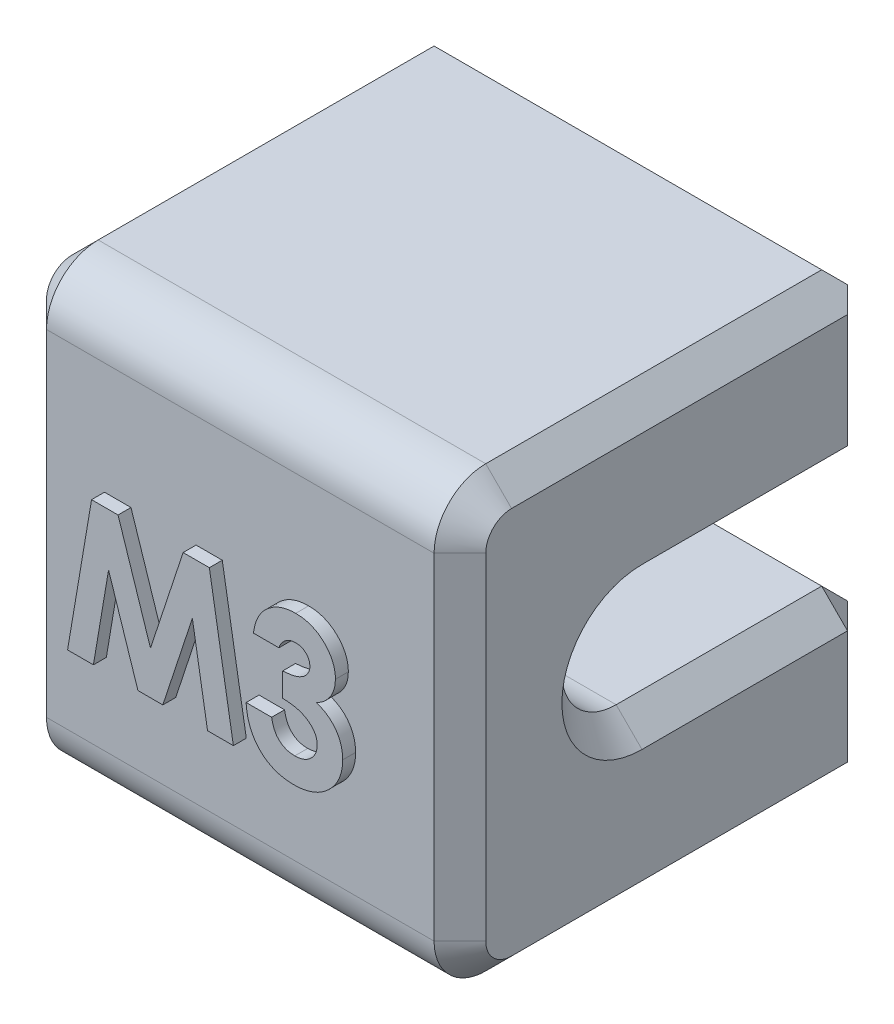
from build123d import *

# Parameters (mm, degrees)
SKETCH1_W           = 17
SKETCH1_H           = 17
BOSS_EXTRUDE1_DEPTH = 16
CUT_EXTRUDE1_DEPTH  = 29.879058156
CHAMFER1_SIZE       = 1
FILLET1_R           = 2
BOSS_EXTRUDE2_DEPTH = 0.5
CHAMFER3_SIZE       = 1


with BuildPart() as part:
    # Sketch1 → Boss-Extrude1 (new body)
    with BuildSketch(Plane.XY):
        with Locations((8.5, 8.5)):
            Rectangle(SKETCH1_W, SKETCH1_H)
    extrude(amount=BOSS_EXTRUDE1_DEPTH)

    # Sketch2 → Cut-Extrude1 (cut, through all)
    with BuildSketch(Plane.ZY):
        with BuildLine():
            Line((8.953848021, 10.6), (0, 10.6))
            Line((0, 10.6), (0, 6.4))
            Line((0, 6.4), (8.953848021, 6.4))
            ThreePointArc((8.953848021, 6.4), (11.053848021, 8.5), (8.953848021, 10.6))
        make_face()
    extrude(amount=-CUT_EXTRUDE1_DEPTH, mode=Mode.SUBTRACT)

    # Chamfer1
    chamfer1_edges = [part.edges().sort_by_distance(p)[0] for p in [
        (0, 3.2, 0),
        (17, 13.8, 0),
        (17, 8.5, 11.053848021),
        (17, 6.4, 4.47692401),
        (8.5, 6.4, 0),
        (17, 10.6, 4.47692401),
        (8.5, 10.6, 0),
        (0, 8.5, 11.053848021),
        (0, 10.6, 4.47692401),
        (0, 6.4, 4.47692401),
        (8.5, 17, 0),
        (17, 3.2, 0),
        (8.5, 0, 0),
        (0, 13.8, 0),
    ]]
    chamfer(chamfer1_edges, length=CHAMFER1_SIZE)

    # Fillet1
    fillet1_edges = [part.edges().sort_by_distance(p)[0] for p in [
        (8.5, 17, 16),
        (8.5, 0, 16),
    ]]
    fillet(fillet1_edges, radius=FILLET1_R)

    # Sketch3 → Boss-Extrude2 (add)
    with BuildSketch(Plane.XY.offset(16)):
        Polygon((3.244919175, 10.668082206), (4.269558598, 10.668082206), (5.524466451, 6.831744065), (6.788188406, 10.668082206), (7.802911963, 10.668082206), (8.732799784, 5.168082206), (7.733500906, 5.168082206), (7.146261322, 8.641940379), (6.002631515, 5.168082206), (5.039690809, 5.168082206), (3.902671579, 8.641940379), (3.316533758, 5.168082206), (2.316133117, 5.168082206), align=None)
        with BuildLine():
            Line((10.495620297, 9.328338616), (9.508440809, 9.328338616))
            add(Edge.make_bspline(
                [(9.508440809, 9.328338616), (9.515410672, 9.377684197), (9.529074626, 9.47442294), (9.56177064, 9.61447654), (9.600878602, 9.747326965), (9.649702894, 9.872553504), (9.706965845, 9.990379227), (9.772085156, 10.101208455), (9.84576479, 10.204565488), (9.90224101, 10.266828175), (9.93041597, 10.297889898)],
                knots=[0, 0, 0, 0, 1.111473889, 2.178970933, 3.205615836, 4.199322666, 5.174200091, 6.12565194, 7.064921805, 8, 8, 8, 8], degree=3))
            add(Edge.make_bspline(
                [(9.93041597, 10.297889898), (9.971054616, 10.338873592), (10.051149118, 10.419648144), (10.184996423, 10.523111423), (10.325293118, 10.612651854), (10.474852914, 10.683640156), (10.631348547, 10.741096963), (10.796024526, 10.779690829), (10.968207924, 10.805298201), (11.085701432, 10.807820616), (11.145660361, 10.809107847)],
                knots=[0, 0, 0, 0, 1.01925491, 2.00884431, 2.983262333, 3.955970413, 4.92937149, 5.924503185, 6.940838805, 8, 8, 8, 8], degree=3))
            add(Edge.make_bspline(
                [(11.145660361, 10.809107847), (11.198966933, 10.807849383), (11.303756913, 10.805375497), (11.457771816, 10.785516482), (11.604612137, 10.750685982), (11.745830021, 10.705145883), (11.879348613, 10.643180969), (12.008114798, 10.571252892), (12.128530844, 10.483030116), (12.240878502, 10.383347258), (12.344091254, 10.275530489), (12.433473949, 10.160283229), (12.510317856, 10.040683999), (12.573627071, 9.915739156), (12.622303254, 9.785237276), (12.656085968, 9.649932253), (12.678197575, 9.510122647), (12.680400469, 9.415095941), (12.681517733, 9.366900315)],
                knots=[0, 0, 0, 0, 1.091422571, 2.145516843, 3.172569842, 4.178562979, 5.178154469, 6.181868002, 7.194278174, 8.227918432, 9.254613415, 10.245994977, 11.209837596, 12.161663635, 13.10878368, 14.055455738, 15.013766427, 16, 16, 16, 16], degree=3))
            add(Edge.make_bspline(
                [(12.681517733, 9.366900315), (12.679225042, 9.307214046), (12.674711438, 9.189710131), (12.637674052, 9.017734423), (12.579700472, 8.853294955), (12.495951997, 8.698692484), (12.391245073, 8.55434775), (12.262773184, 8.425086631), (12.114195543, 8.308882488), (12.002656329, 8.246434368), (11.945540168, 8.214456405)],
                knots=[0, 0, 0, 0, 0.992805628, 1.954529043, 2.915727527, 3.886831945, 4.871318353, 5.87440735, 6.911542536, 8, 8, 8, 8], degree=3))
            add(Edge.make_bspline(
                [(11.945540168, 8.214456405), (11.984743825, 8.201585019), (12.061777251, 8.176293323), (12.171271003, 8.126481615), (12.275387051, 8.072045674), (12.372332552, 8.00880546), (12.463071747, 7.939318128), (12.547051478, 7.862989674), (12.624773506, 7.77998653), (12.69496905, 7.689852211), (12.757270338, 7.594028239), (12.813169966, 7.494728091), (12.859178476, 7.390445863), (12.898153411, 7.282372527), (12.927826708, 7.169536779), (12.948719361, 7.052375846), (12.960795827, 6.931156981), (12.962637694, 6.849031274), (12.963569015, 6.807505283)],
                knots=[0, 0, 0, 0, 1.059543567, 2.081955587, 3.086750234, 4.076226789, 5.052108497, 6.020845489, 6.989030705, 7.970690546, 8.952259656, 9.923888338, 10.895517021, 11.877585046, 12.873342345, 13.889638361, 14.932918083, 16, 16, 16, 16], degree=3))
            add(Edge.make_bspline(
                [(12.963569015, 6.807505283), (12.961681103, 6.746478937), (12.957958525, 6.626147412), (12.93429212, 6.448911389), (12.890229538, 6.279932588), (12.83226277, 6.117266652), (12.754941393, 5.96301354), (12.663947131, 5.813633354), (12.5520969, 5.674306556), (12.427794574, 5.541349707), (12.289749595, 5.420471294), (12.140086379, 5.315675149), (11.982095893, 5.225741411), (11.814778577, 5.15273064), (11.638192558, 5.096503997), (11.452731433, 5.055860787), (11.257615945, 5.030994598), (11.124434358, 5.02838785), (11.056417572, 5.027056565)],
                knots=[0, 0, 0, 0, 1.005138573, 1.981928558, 2.936866704, 3.876260664, 4.820238198, 5.773547, 6.751179199, 7.756627054, 8.768222608, 9.766606018, 10.760583154, 11.757261445, 12.767156078, 13.807575856, 14.880313354, 16, 16, 16, 16], degree=3))
            add(Edge.make_bspline(
                [(11.056417572, 5.027056565), (10.99207479, 5.02846018), (10.866260993, 5.031204763), (10.682231983, 5.054960522), (10.507329828, 5.093280489), (10.341108177, 5.147295661), (10.184210125, 5.217344107), (10.035212862, 5.300756089), (9.897089595, 5.402342616), (9.768301357, 5.517517881), (9.651705062, 5.646737988), (9.547495432, 5.787009618), (9.457970308, 5.938866167), (9.382762546, 6.10165884), (9.3224601, 6.275673225), (9.274893708, 6.460555454), (9.241667805, 6.656666729), (9.231548786, 6.791595459), (9.226389527, 6.860389898)],
                knots=[0, 0, 0, 0, 1.066544725, 2.085487077, 3.070979577, 4.031932826, 4.977951092, 5.916076795, 6.857635327, 7.814973522, 8.776389752, 9.738577119, 10.707772778, 11.69409279, 12.707140348, 13.757286496, 14.856535458, 16, 16, 16, 16], degree=3))
            Line((9.226389527, 6.860389898), (10.213569015, 6.860389898))
            add(Edge.make_bspline(
                [(10.213569015, 6.860389898), (10.219824668, 6.825799151), (10.232009194, 6.7584246), (10.255774364, 6.660881227), (10.286743696, 6.570842669), (10.322551949, 6.487508666), (10.361230253, 6.409785071), (10.407962894, 6.340542409), (10.459325549, 6.277900458), (10.533442235, 6.203431016), (10.639397142, 6.126916773), (10.782471369, 6.060422256), (10.941627897, 6.0214483), (11.052894184, 6.016693597), (11.110403951, 6.014236052)],
                knots=[0, 0, 0, 0, 0.928156231, 1.807827665, 2.648129825, 3.438902246, 4.202261636, 4.936546065, 5.639352463, 6.338805438, 7.70633318, 9.064371875, 10.482673459, 12, 12, 12, 12], degree=3))
            add(Edge.make_bspline(
                [(11.110403951, 6.014236052), (11.140920666, 6.014759363), (11.200696083, 6.015784412), (11.288497271, 6.027145709), (11.372140265, 6.045857774), (11.451780855, 6.071286777), (11.527926037, 6.103163621), (11.599120982, 6.144266905), (11.66681682, 6.192055339), (11.730277635, 6.245782226), (11.788916737, 6.304325301), (11.837707918, 6.369151809), (11.882299527, 6.435027129), (11.915279803, 6.506261054), (11.944177629, 6.57902044), (11.961864575, 6.655946223), (11.975219489, 6.735424708), (11.975995623, 6.789816294), (11.976389527, 6.817421148)],
                knots=[0, 0, 0, 0, 1.110435564, 2.175094844, 3.216326037, 4.226890168, 5.215276772, 6.21526065, 7.213097102, 8.228249917, 9.239874822, 10.221364777, 11.178138315, 12.128914389, 13.072518965, 14.022636769, 14.996447288, 16, 16, 16, 16], degree=3))
            add(Edge.make_bspline(
                [(11.976389527, 6.817421148), (11.975343786, 6.84761176), (11.973261954, 6.907714349), (11.95625317, 6.99542144), (11.929392706, 7.079788593), (11.892080239, 7.16044219), (11.842253599, 7.237084958), (11.783458719, 7.311254584), (11.711063536, 7.37909067), (11.631636324, 7.446144585), (11.539531961, 7.504595376), (11.43923606, 7.558536867), (11.328112687, 7.601457641), (11.208874464, 7.639793843), (11.079265887, 7.667794008), (10.94009178, 7.688124858), (10.791576649, 7.703258025), (10.689203239, 7.705429126), (10.636645938, 7.706543745)],
                knots=[0, 0, 0, 0, 0.809814727, 1.612155564, 2.388397, 3.182215007, 3.988903953, 4.837162975, 5.715530372, 6.646997145, 7.623086902, 8.637258368, 9.698941581, 10.815059213, 11.996518529, 13.252603015, 14.589518788, 16, 16, 16, 16], degree=3))
            Line((10.636645938, 7.706543745), (10.636645938, 8.623210411))
            add(Edge.make_bspline(
                [(10.636645938, 8.623210411), (10.702082904, 8.628783233), (10.824502508, 8.639208878), (10.994427483, 8.663589612), (11.137482407, 8.696178476), (11.257105609, 8.735495178), (11.356433051, 8.785988065), (11.443204956, 8.841729984), (11.517937025, 8.906466075), (11.581095648, 8.978265919), (11.631620581, 9.055372218), (11.667379186, 9.136586513), (11.6909923, 9.219395932), (11.693229641, 9.276035079), (11.694338245, 9.304099834)],
                knots=[0, 0, 0, 0, 1.70044513, 3.18119609, 4.440695891, 5.496282586, 6.431922213, 7.318171381, 8.16090191, 8.983045123, 9.787564368, 10.536848927, 11.275007137, 12, 12, 12, 12], degree=3))
            add(Edge.make_bspline(
                [(11.694338245, 9.304099834), (11.692425585, 9.339907415), (11.688692477, 9.409796232), (11.659699137, 9.509821852), (11.609369984, 9.598986402), (11.541887427, 9.677102254), (11.459657586, 9.742350468), (11.363269796, 9.789719559), (11.254815679, 9.817551015), (11.178512364, 9.820436199), (11.139049784, 9.82192836)],
                knots=[0, 0, 0, 0, 1.009664648, 1.970651636, 2.907870547, 3.878035693, 4.867062054, 5.849714035, 6.887914197, 8, 8, 8, 8], degree=3))
            add(Edge.make_bspline(
                [(11.139049784, 9.82192836), (11.103281391, 9.820167767), (11.032305946, 9.816674212), (10.9285186, 9.79059924), (10.8299552, 9.746705269), (10.738656716, 9.686178071), (10.655941059, 9.613487472), (10.588055369, 9.527400545), (10.531591271, 9.433074908), (10.507657627, 9.363387579), (10.495620297, 9.328338616)],
                knots=[0, 0, 0, 0, 0.98818071, 1.960853194, 2.938124878, 3.957524365, 4.978590984, 5.968022688, 6.978025184, 8, 8, 8, 8], degree=3))
        make_face()
    extrude(amount=BOSS_EXTRUDE2_DEPTH)

    # Chamfer3
    chamfer3_edges = [part.edges().sort_by_distance(p)[0] for p in [
        (0, 8.5, 16),
        (17, 8.5, 16),
        (17, 0, 7.5),
        (17, 17, 7.5),
        (17, 16.414213562, 15.414213562),
        (17, 0.585786438, 15.414213562),
        (0, 0, 7.5),
        (0, 17, 7.5),
        (0, 16.414213562, 15.414213562),
        (0, 0.585786438, 15.414213562),
    ]]
    chamfer(chamfer3_edges, length=CHAMFER3_SIZE)


solid = part.part
